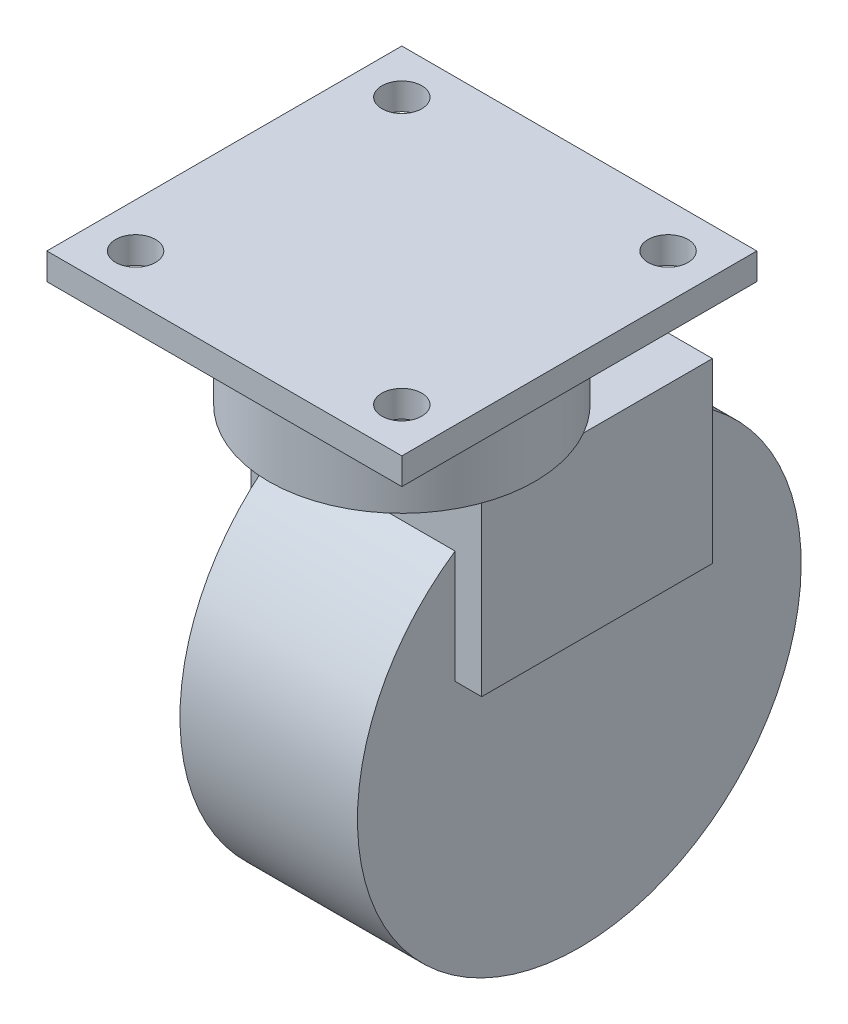
from build123d import *

# Parameters (mm, degrees)
SK_PLATE_W              = 40
SK_PLATE_H              = 40
EX_PLATE_DEPTH          = 3
SK_PLATEHOLES_4X_R      = 2.25
CUT_PLATEHOLES_4X_DEPTH = 3
SK_SWIVEL_R             = 15
EX_SWIVEL_DEPTH         = 12
SK_FORK_W               = 26
SK_FORK_H               = 26
EX_FORK_DEPTH           = 20
SK_WHEEL_R              = 25
EX_WHEEL_DEPTH          = 20


with BuildPart() as part:
    # SK_Plate → EX_Plate (new body)
    with BuildSketch(Plane(origin=(0, 0, 0), x_dir=(1, 0, 0), z_dir=(0, 1, 0))):
        Rectangle(SK_PLATE_W, SK_PLATE_H)
    extrude(amount=-EX_PLATE_DEPTH)

    # SK_PlateHoles_4x → CUT_PlateHoles_4x (cut)
    with BuildSketch(Plane(origin=(0, 0, 0), x_dir=(1, 0, 0), z_dir=(0, 1, 0))):
        with Locations((15, -15)):
            Circle(SK_PLATEHOLES_4X_R)
        with Locations((-15, -15)):
            Circle(SK_PLATEHOLES_4X_R)
        with Locations((15, 15)):
            Circle(SK_PLATEHOLES_4X_R)
        with Locations((-15, 15)):
            Circle(SK_PLATEHOLES_4X_R)
    extrude(amount=-CUT_PLATEHOLES_4X_DEPTH, mode=Mode.SUBTRACT)

    # SK_Swivel → EX_Swivel (add)
    with BuildSketch(Plane(origin=(0, -3, 0), x_dir=(1, 0, 0), z_dir=(0, 1, 0))):
        Circle(SK_SWIVEL_R)
    extrude(amount=-EX_SWIVEL_DEPTH)

    # SK_Fork → EX_Fork (add)
    with BuildSketch(Plane(origin=(0, -15, 0), x_dir=(1, 0, 0), z_dir=(0, 1, 0))):
        with Locations((0, 9)):
            Rectangle(SK_FORK_W, SK_FORK_H)
    extrude(amount=-EX_FORK_DEPTH)

    # SK_Wheel → EX_Wheel (add)
    with BuildSketch(Plane(origin=(-10, 0, 0), x_dir=(0, 0, -1), z_dir=(1, 0, 0))):
        with Locations((10, -43)):
            Circle(SK_WHEEL_R)
    extrude(amount=EX_WHEEL_DEPTH)


solid = part.part
